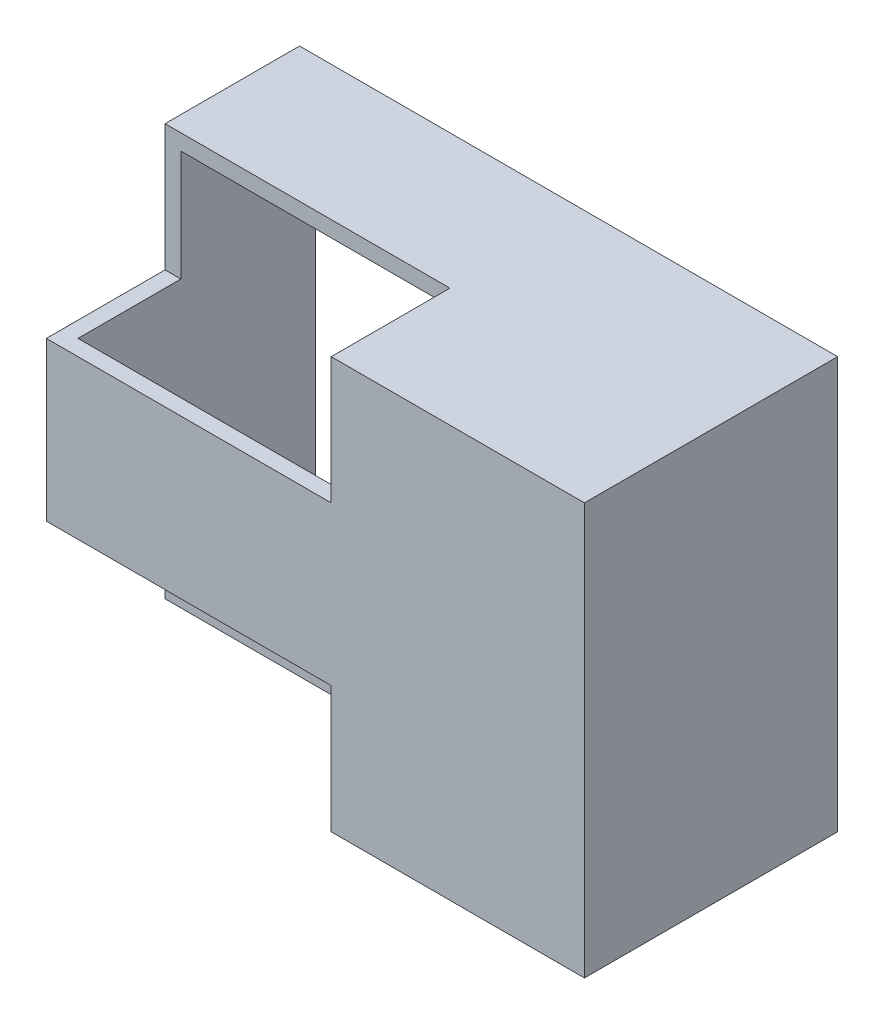
from build123d import *

# Parameters (mm, degrees)
SKETCH1_W           = 86.36
SKETCH1_H           = 66.04
BOSS_EXTRUDE1_DEPTH = 40.64
SKETCH2_W           = 81.28
SKETCH2_H           = 60.96
CUT_EXTRUDE1_DEPTH  = 38.1
SKETCH3_W           = 45.72
SKETCH3_H           = 20.32
CUT_EXTRUDE2_DEPTH  = 19.05
SKETCH4_W           = 45.72
SKETCH4_H           = 20.32
CUT_EXTRUDE3_DEPTH  = 19.05


with BuildPart() as part:
    # Sketch1 → Boss-Extrude1 (new body)
    with BuildSketch(Plane.XY):
        Rectangle(SKETCH1_W, SKETCH1_H)
    extrude(amount=BOSS_EXTRUDE1_DEPTH)

    # Sketch2 → Cut-Extrude1 (cut)
    with BuildSketch(Plane(origin=(0, 0, 0), x_dir=(-1, 0, 0), z_dir=(0, 0, -1))):
        Rectangle(SKETCH2_W, SKETCH2_H)
    extrude(amount=-CUT_EXTRUDE1_DEPTH, mode=Mode.SUBTRACT)

    # Sketch3 → Cut-Extrude2 (cut)
    with BuildSketch(Plane.XY.offset(40.64)):
        with Locations((-20.32, 22.86)):
            Rectangle(SKETCH3_W, SKETCH3_H)
    extrude(amount=-CUT_EXTRUDE2_DEPTH, mode=Mode.SUBTRACT)

    # Sketch4 → Cut-Extrude3 (cut)
    with BuildSketch(Plane.XY.offset(40.64)):
        with Locations((-20.32, -22.86)):
            Rectangle(SKETCH4_W, SKETCH4_H)
    extrude(amount=-CUT_EXTRUDE3_DEPTH, mode=Mode.SUBTRACT)


solid = part.part
